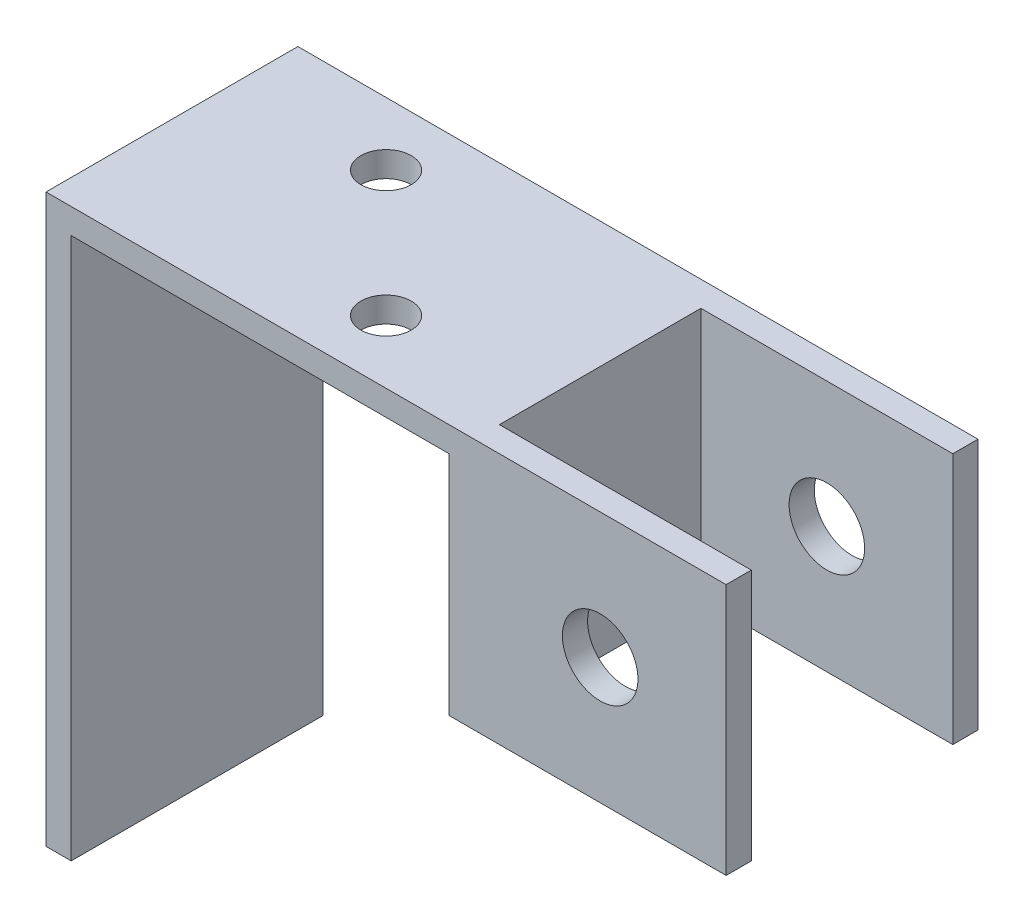
from build123d import *

# Parameters (mm, degrees)
BOSS_EXTRUDE1_DEPTH     = 20
SKETCH2_R               = 2
CUT_EXTRUDE1_DEPTH      = 20
SKETCH3_W               = 2
SKETCH3_H               = 20
BOSS_EXTRUDE2_DEPTH     = 20
CUT_EXTRUDE2_DEPTH      = 60.712985217
CUT_EXTRUDE2_DEPTH_BACK = 60.712985217
SKETCH4_R               = 3


with BuildPart() as part:
    # Sketch1 → Boss-Extrude1 (new body)
    with BuildSketch(Plane.XY):
        Polygon((-8.296296296, 12.185185185), (-8.296296296, -32.814814815), (-6.296296296, -32.814814815), (-6.296296296, 10.185185185), (23.703703704, 10.185185185), (23.703703704, -7.814814815), (25.703703704, -7.814814815), (25.703703704, 12.185185185), align=None)
    extrude(amount=BOSS_EXTRUDE1_DEPTH)

    # Sketch2 → Cut-Extrude1 (cut)
    with BuildSketch(Plane(origin=(0, 12.185185185, 0), x_dir=(1, 0, 0), z_dir=(0, 1, 0))):
        with Locations(Location((13.703703704, -15, 0), (0, 0, 180))):
            Circle(SKETCH2_R)
        with Locations(Location((3.703703704, -5, 0), (0, 0, 180))):
            Circle(SKETCH2_R)
    extrude(amount=-CUT_EXTRUDE1_DEPTH, mode=Mode.SUBTRACT)

    # Sketch3 → Boss-Extrude2 (add)
    with BuildSketch(Plane(origin=(25.703703704, 0, 0), x_dir=(0, 0, -1), z_dir=(1, 0, 0))):
        with Locations((-19, 2.185185185)):
            Rectangle(SKETCH3_W, SKETCH3_H)
        with Locations((-1, 2.185185185)):
            Rectangle(SKETCH3_W, SKETCH3_H)
    extrude(amount=BOSS_EXTRUDE2_DEPTH)

    # Sketch4 → Cut-Extrude2 (cut, two sides: drawn at the far end of the back side and taken through both)
    with BuildSketch(Plane(origin=(0, 0, 0), x_dir=(-1, 0, 0), z_dir=(0, 0, -1)).offset(-CUT_EXTRUDE2_DEPTH_BACK)):
        with Locations((-35.703703704, 2.185185185)):
            Circle(SKETCH4_R)
    extrude(amount=CUT_EXTRUDE2_DEPTH + CUT_EXTRUDE2_DEPTH_BACK, mode=Mode.SUBTRACT)


solid = part.part
